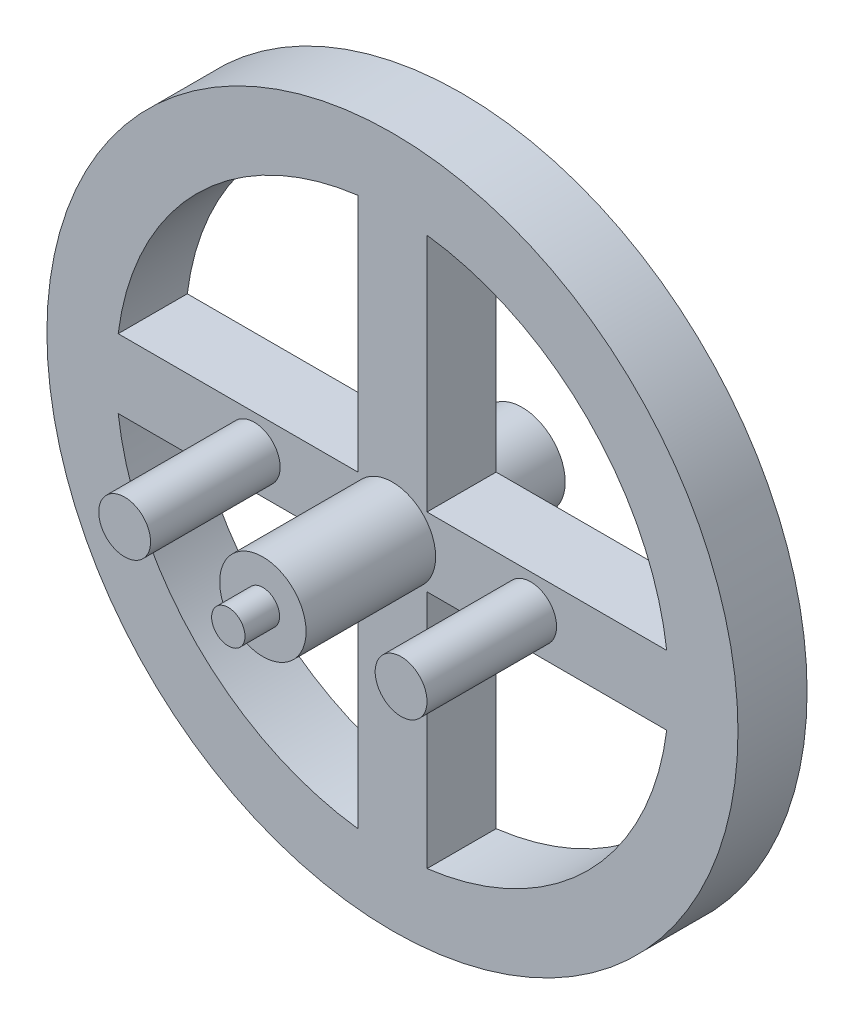
from build123d import *

# Parameters (mm, degrees)
ESQUISSE1_R        = 20
BOSS_EXTRU_1_DEPTH = 4
ESQUISSE2_R        = 2.5
BOSS_EXTRU_2_DEPTH = 7.5
ESQUISSE3_R        = 0.966516747
BOSS_EXTRU_3_DEPTH = 2
ESQUISSE4_R        = 1.5
BOSS_EXTRU_4_DEPTH = 7.5


with BuildPart() as part:
    # Esquisse1 → Boss.-Extru.1 (new body)
    with BuildSketch(Plane.XY):
        Circle(ESQUISSE1_R)
        with BuildLine():
            Line((-15.874507866, 2), (-2, 2))
            Line((-2, 2), (-2, 15.874507866))
            ThreePointArc((-2, 15.874507866), (-11.313708499, 11.313708499), (-15.874507866, 2))
        make_face(mode=Mode.SUBTRACT)
        with BuildLine():
            Line((-15.874507866, -2), (-2, -2))
            Line((-2, -2), (-2, -15.874507866))
            ThreePointArc((-2, -15.874507866), (-11.313708499, -11.313708499), (-15.874507866, -2))
        make_face(mode=Mode.SUBTRACT)
        with BuildLine():
            Line((2, 15.874507866), (2, 2))
            Line((2, 2), (15.874507866, 2))
            ThreePointArc((15.874507866, 2), (11.313708499, 11.313708499), (2, 15.874507866))
        make_face(mode=Mode.SUBTRACT)
        with BuildLine():
            Line((2, -2), (2, -15.874507866))
            ThreePointArc((2, -15.874507866), (11.313708499, -11.313708499), (15.874507866, -2))
            Line((15.874507866, -2), (2, -2))
        make_face(mode=Mode.SUBTRACT)
    extrude(amount=BOSS_EXTRU_1_DEPTH)

    # Esquisse2 → Boss.-Extru.2 (add, symmetric)
    with BuildSketch(Plane.XY.offset(4)):
        Circle(ESQUISSE2_R)
    extrude(amount=BOSS_EXTRU_2_DEPTH, both=True)

    # Esquisse3 → Boss.-Extru.3 (add)
    with BuildSketch(Plane.XY.offset(11.5)):
        Circle(ESQUISSE3_R)
    extrude(amount=BOSS_EXTRU_3_DEPTH)

    # Esquisse4 → Boss.-Extru.4 (add)
    with BuildSketch(Plane.XY.offset(4)):
        with Locations((8, 0)):
            Circle(ESQUISSE4_R)
        with Locations((-8, 0)):
            Circle(ESQUISSE4_R)
    extrude(amount=BOSS_EXTRU_4_DEPTH)


solid = part.part
